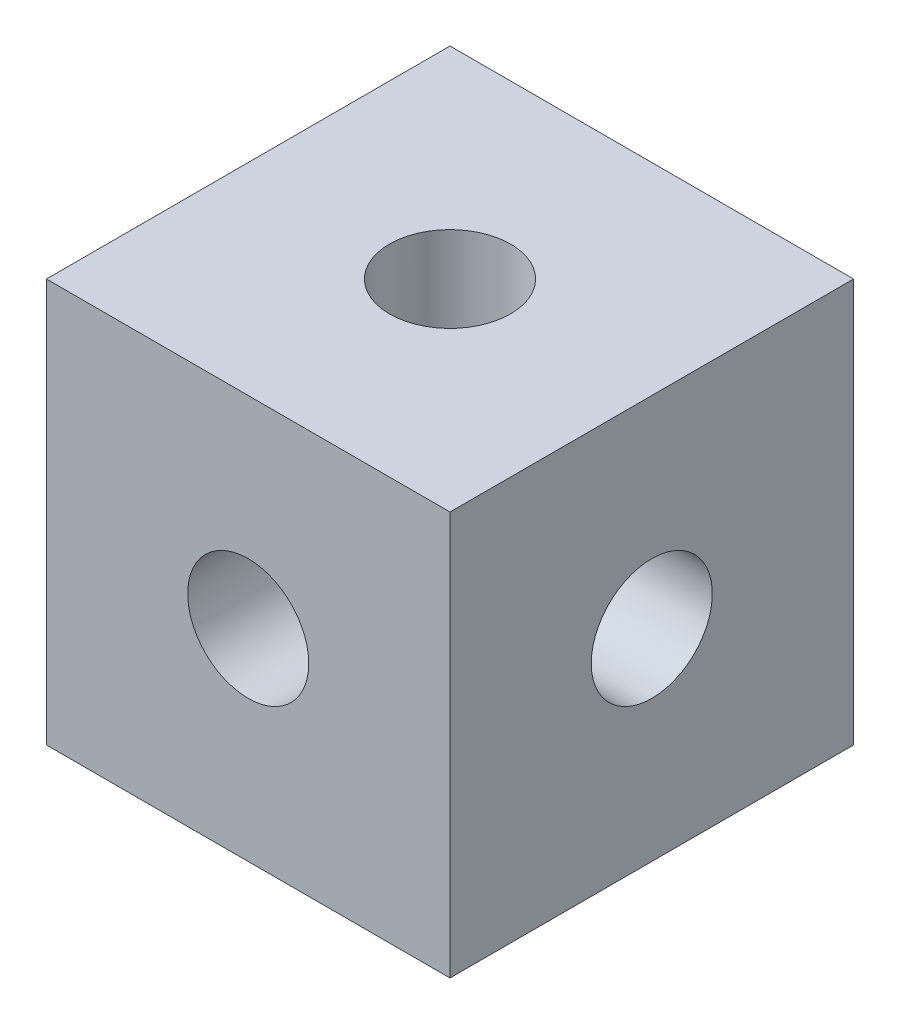
from build123d import *

# Parameters (mm, degrees)
SKETCH_2_W          = 10
SKETCH_2_H          = 10
SKETCH_2_R          = 1.5
EXTRUDE_1_DEPTH     = 10
SKETCH_3_R          = 1.5
CUT_EXTRUDE_1_DEPTH = 10
SKETCH_4_R          = 1.5
CUT_EXTRUDE_2_DEPTH = 10


with BuildPart() as part:
    # 草图2 → 凸台-拉伸1 (new body)
    with BuildSketch(Plane.XY):
        Rectangle(SKETCH_2_W, SKETCH_2_H)
        Circle(SKETCH_2_R, mode=Mode.SUBTRACT)
    extrude(amount=EXTRUDE_1_DEPTH)

    # 草图3 → 切除-拉伸1 (cut)
    with BuildSketch(Plane(origin=(0, 5, 0), x_dir=(1, 0, 0), z_dir=(0, 1, 0))):
        with Locations(Location((0, -5, 0), (0, 0, 270))):
            Circle(SKETCH_3_R)
    extrude(amount=-CUT_EXTRUDE_1_DEPTH, mode=Mode.SUBTRACT)

    # 草图4 → 切除-拉伸2 (cut)
    with BuildSketch(Plane.ZY.offset(5)):
        with Locations((5, 0)):
            Circle(SKETCH_4_R)
    extrude(amount=-CUT_EXTRUDE_2_DEPTH, mode=Mode.SUBTRACT)


solid = part.part
